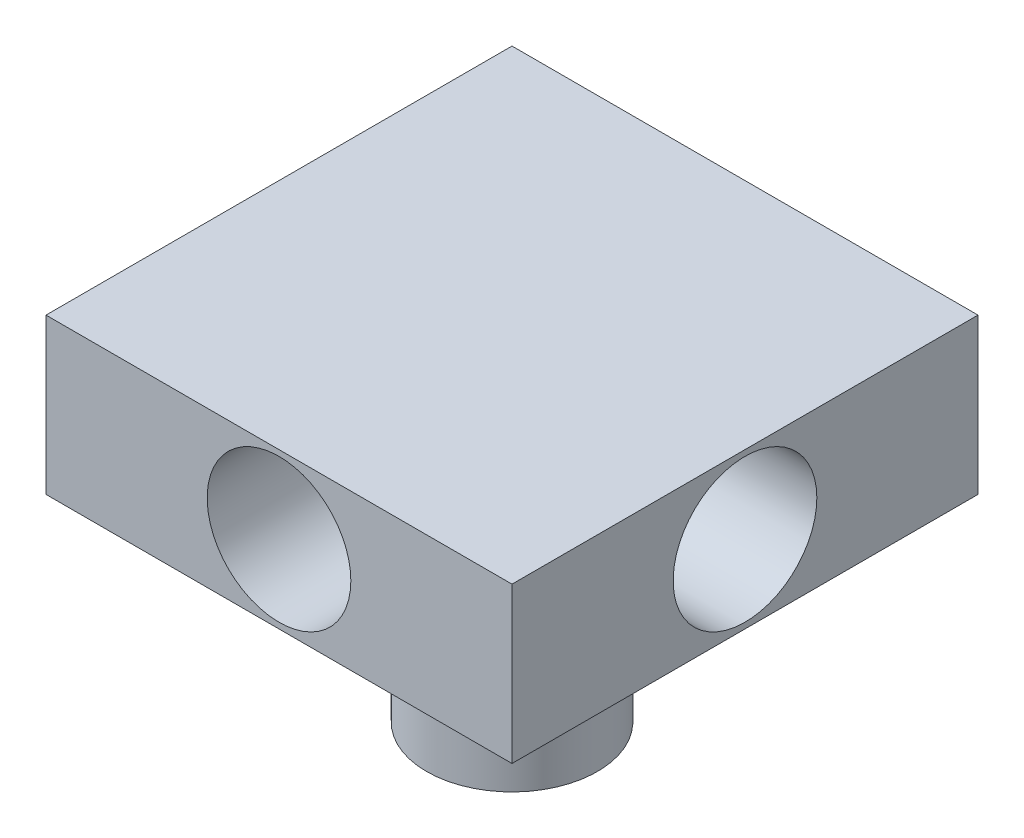
from build123d import *

# Parameters (mm, degrees)
SKETCH1_R           = 11
BOSS_EXTRUDE1_DEPTH = 25.4
SKETCH13_W          = 60
SKETCH13_H          = 60
BOSS_EXTRUDE5_DEPTH = 20
FACE_1_R            = 9.25
CUT_EXTRUDE1_DEPTH  = 20
FACE_3_R            = 9.25
CUT_EXTRUDE2_DEPTH  = 20
CUT_EXTRUDE3_START  = -20
FACE_2_R            = 9.25
CUT_EXTRUDE3_DEPTH  = 20


with BuildPart() as part:
    # Sketch1 → Boss-Extrude1 (new body)
    with BuildSketch(Plane(origin=(0, 0, 0), x_dir=(1, 0, 0), z_dir=(0, 1, 0))):
        with Locations(Location((0, 0, 0), (0, 0, 270))):
            Circle(SKETCH1_R)
    extrude(amount=BOSS_EXTRUDE1_DEPTH)

    # Sketch13 → Boss-Extrude5 (add)
    with BuildSketch(Plane(origin=(0, 25.4, 0), x_dir=(1, 0, 0), z_dir=(0, 1, 0))):
        Rectangle(SKETCH13_W, SKETCH13_H)
    extrude(amount=BOSS_EXTRUDE5_DEPTH)

    # Face 1 → Cut-Extrude1 (cut)
    with BuildSketch(Plane.XY.offset(30)):
        with Locations((0, 35.4)):
            Circle(FACE_1_R)
    extrude(amount=-CUT_EXTRUDE1_DEPTH, mode=Mode.SUBTRACT)

    # Face 3 → Cut-Extrude2 (cut)
    with BuildSketch(Plane.ZY.offset(30)):
        with Locations((0, 35.4)):
            Circle(FACE_3_R)
    extrude(amount=-CUT_EXTRUDE2_DEPTH, mode=Mode.SUBTRACT)

    # Face 2 → Cut-Extrude3 (cut)
    with BuildSketch(Plane(origin=(30, 0, 0), x_dir=(0, 0, -1), z_dir=(1, 0, 0)).offset(CUT_EXTRUDE3_START)):
        with Locations(Location((0, 35.4, 0), (0, 0, 180))):
            Circle(FACE_2_R)
    extrude(amount=CUT_EXTRUDE3_DEPTH, mode=Mode.SUBTRACT)


solid = part.part
